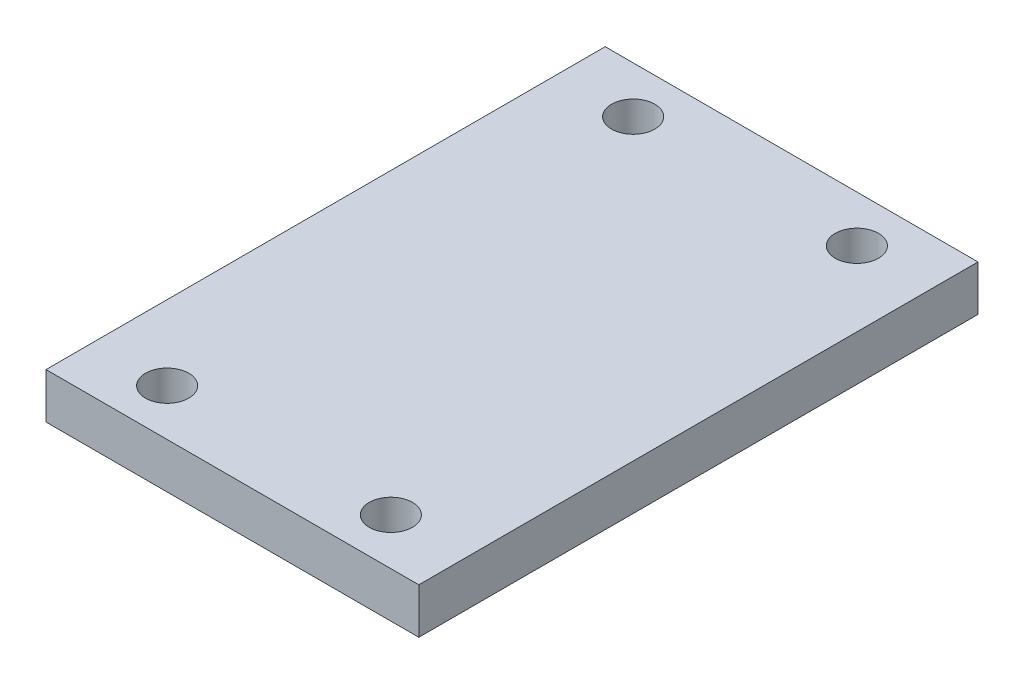
from build123d import *

# Parameters (mm, degrees)
SKETCH1_W           = 25.4
SKETCH1_H           = 38.1
SKETCH1_R           = 1.4732
BOSS_EXTRUDE1_DEPTH = 3.0988


with BuildPart() as part:
    # Sketch1 → Boss-Extrude1 (new body)
    with BuildSketch(Plane(origin=(0, 0, 0), x_dir=(1, 0, 0), z_dir=(0, 1, 0))):
        with Locations((-12.7, 0)):
            Rectangle(SKETCH1_W, SKETCH1_H)
        with Locations(Location((-5.08, 15.875, 0), (0, 0, 270))):
            Circle(SKETCH1_R, mode=Mode.SUBTRACT)
        with Locations(Location((-20.32, -15.875, 0), (0, 0, 270))):
            Circle(SKETCH1_R, mode=Mode.SUBTRACT)
        with Locations(Location((-20.32, 15.875, 0), (0, 0, 90))):
            Circle(SKETCH1_R, mode=Mode.SUBTRACT)
        with Locations(Location((-5.08, -15.875, 0), (0, 0, 90))):
            Circle(SKETCH1_R, mode=Mode.SUBTRACT)
    extrude(amount=BOSS_EXTRUDE1_DEPTH)


solid = part.part
